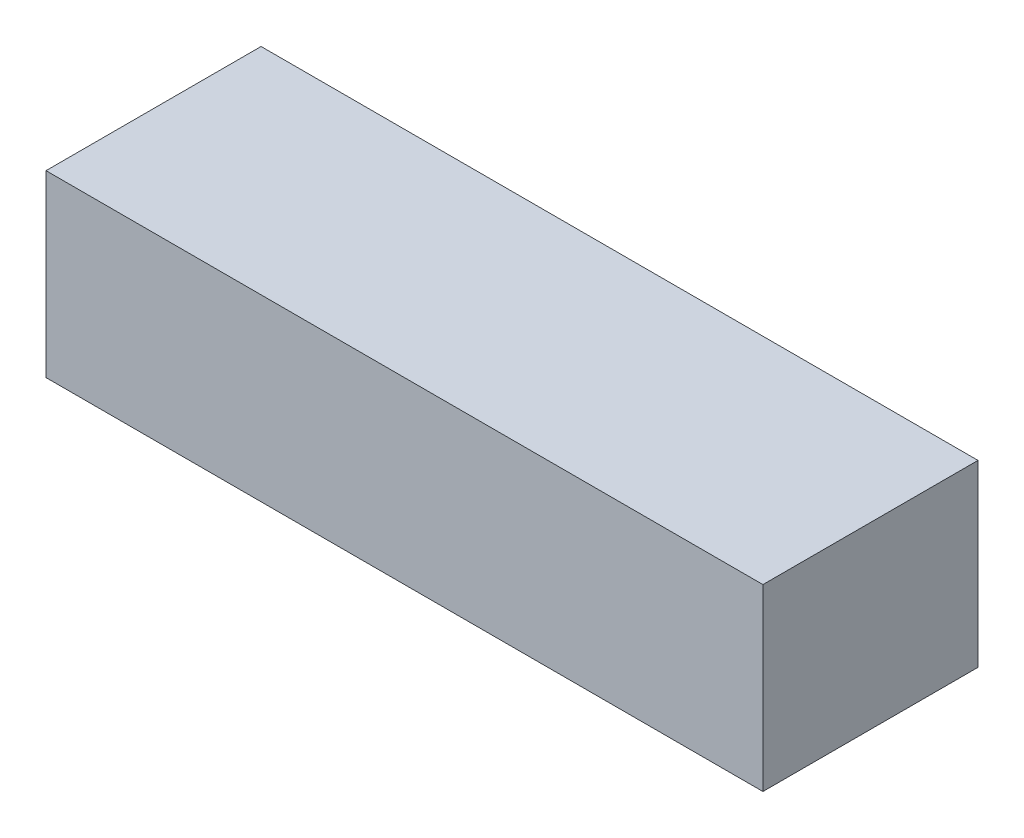
from build123d import *

# Parameters (mm, degrees)
SKETCH_1_W      = 20
SKETCH_1_H      = 6
EXTRUDE_1_DEPTH = 5


with BuildPart() as part:
    # 草图1 → 凸台-拉伸1 (new body)
    with BuildSketch(Plane(origin=(0, 0, 0), x_dir=(1, 0, 0), z_dir=(0, 1, 0))):
        with Locations((17.774451091, 3)):
            Rectangle(SKETCH_1_W, SKETCH_1_H)
    extrude(amount=EXTRUDE_1_DEPTH)


solid = part.part
